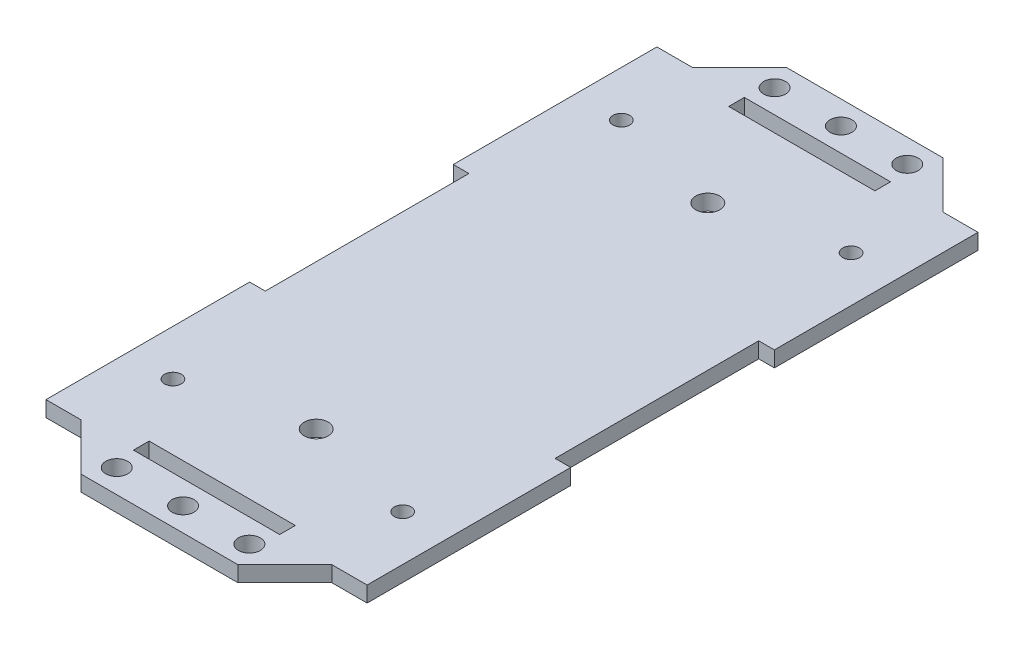
from build123d import *

# Parameters (mm, degrees)
SKETCH1_R           = 2.3
SKETCH1_R_2         = 1.609204822
BOSS_EXTRUDE1_DEPTH = 3
SKETCH2_R           = 2.1
BOSS_EXTRUDE2_DEPTH = 3


with BuildPart() as part:
    # Sketch1 → Boss-Extrude1 (new body)
    with BuildSketch(Plane(origin=(0, 0, 0), x_dir=(1, 0, 0), z_dir=(0, 1, 0))):
        Polygon((-30.75, 58.5), (-30.75, 19.5), (-27.75, 19.5), (-27.75, -19.5), (-30.75, -19.5), (-30.75, -58.5), (-14, -58.5), (-14, -55.5), (14, -55.5), (14, -58.5), (30.75, -58.5), (30.75, -19.5), (27.75, -19.5), (27.75, 19.5), (30.75, 19.5), (30.75, 58.5), (14, 58.5), (14, 55.5), (-14, 55.5), (-14, 58.5), align=None)
        with Locations(Location((0, 37.5, 0), (0, 0, 270))):
            Circle(SKETCH1_R, mode=Mode.SUBTRACT)
        with Locations(Location((0, -37.5, 0), (0, 0, 270))):
            Circle(SKETCH1_R, mode=Mode.SUBTRACT)
        with Locations(Location((-22, -42.94, 0), (0, 0, 270))):
            Circle(SKETCH1_R_2, mode=Mode.SUBTRACT)
        with Locations(Location((22, -42.94, 0), (0, 0, 270))):
            Circle(SKETCH1_R_2, mode=Mode.SUBTRACT)
        with Locations(Location((22, 42.94, 0), (0, 0, 270))):
            Circle(SKETCH1_R_2, mode=Mode.SUBTRACT)
        with Locations(Location((-22, 42.94, 0), (0, 0, 270))):
            Circle(SKETCH1_R_2, mode=Mode.SUBTRACT)
    extrude(amount=BOSS_EXTRUDE1_DEPTH)

    # Sketch2 → Boss-Extrude2 (add)
    with BuildSketch(Plane(origin=(0, 3, 0), x_dir=(1, 0, 0), z_dir=(0, 1, 0))):
        Polygon((-24, 58.5), (-15, 67.5), (15, 67.5), (24, 58.5), align=None)
        with Locations(Location((0, 63, 0), (0, 0, 270))):
            Circle(SKETCH2_R, mode=Mode.SUBTRACT)
        with Locations(Location((12.7, 63, 0), (0, 0, 270))):
            Circle(SKETCH2_R, mode=Mode.SUBTRACT)
        with Locations(Location((-12.7, 63, 0), (0, 0, 270))):
            Circle(SKETCH2_R, mode=Mode.SUBTRACT)
    boss_extrude2 = extrude(amount=-BOSS_EXTRUDE2_DEPTH)

    # Mirror1: Boss-Extrude2 across plane
    add(boss_extrude2.mirror(Plane.XY))


solid = part.part
